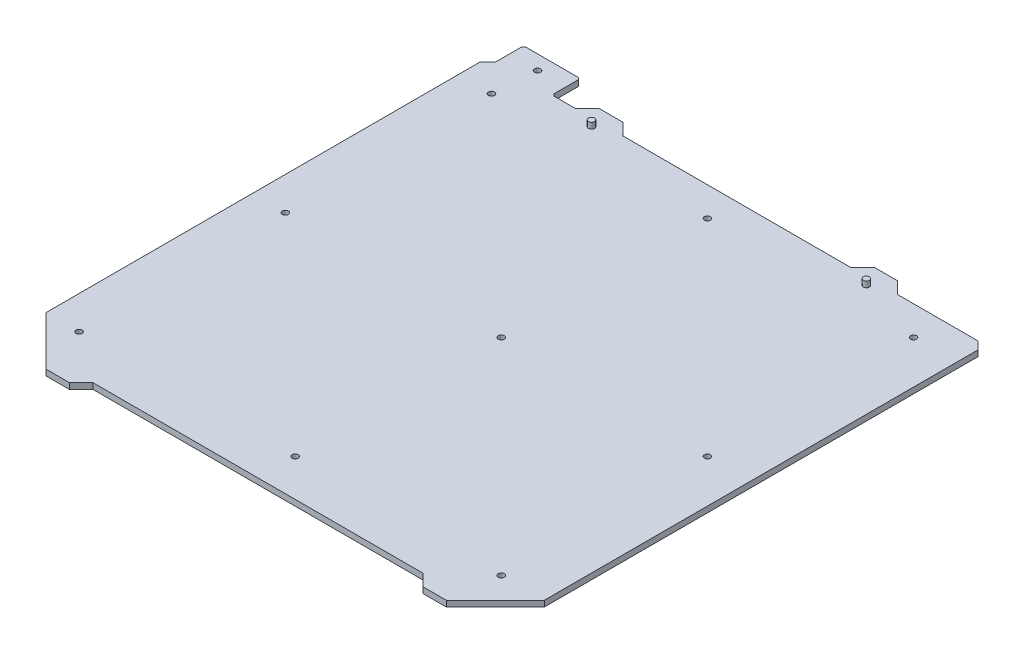
from build123d import *

# Parameters (mm, degrees)
BOSS_EXTRUDE1_DEPTH = 3
SKETCH2_R           = 1.55
CUT_EXTRUDE1_DEPTH  = 356.878676658
BOSS_EXTRUDE3_START = -6
SKETCH3_R           = 1.55
BOSS_EXTRUDE3_DEPTH = 6


with BuildPart() as part:
    # Sketch1 → Boss-Extrude1 (new body)
    with BuildSketch(Plane(origin=(0, 0, 0), x_dir=(1, 0, 0), z_dir=(0, 1, 0))):
        Polygon((5.02071, 249.35), (4.05, 248.379), (4.05, 235), (4.04962, 234.998), (4.04981, 234.996), (4.04812, 234.989), (4.04698, 234.983), (4.04588, 234.981), (4.04531, 234.979), (4.04157, 234.974), (4.0383, 234.968), (4.03662, 234.966), (4.03536, 234.965), (0.095609, 231.025), (0.1, 231), (0.1, 10.0414), (25.0414, -14.9), (36.9586, -14.9), (42.9293, -8.92929), (42.9329, -8.92677), (42.9357, -8.9234), (42.947, -8.91686), (42.9577, -8.90937), (42.962, -8.90823), (42.9658, -8.90603), (42.9787, -8.90376), (42.9913, -8.90038), (42.9957, -8.90076), (43, -8.9), (211, -8.9), (211.004, -8.90076), (211.009, -8.90038), (211.021, -8.90376), (211.034, -8.90603), (211.038, -8.90823), (211.042, -8.90937), (211.053, -8.91687), (211.064, -8.9234), (211.067, -8.92676), (211.071, -8.92929), (217.041, -14.9), (228.959, -14.9), (253.9, 10.0414), (253.9, 230.959), (249.959, 234.9), (209, 234.9), (208.966, 234.906), (208.936, 234.923), (208.913, 234.95), (208.902, 234.983), (208.902, 235.017), (208.904, 235.025), (202.979, 240.95), (191.021, 240.95), (185.096, 235.025), (185.098, 235.017), (185.098, 234.983), (185.087, 234.95), (185.064, 234.923), (185.034, 234.906), (185, 234.9), (69, 234.9), (68.9658, 234.906), (68.9357, 234.923), (68.9134, 234.95), (68.9015, 234.983), (68.9015, 235.017), (68.9043, 235.025), (62.9793, 240.95), (51.0207, 240.95), (45.0957, 235.025), (45.0985, 235.017), (45.0985, 234.983), (45.0866, 234.95), (45.0643, 234.923), (45.0342, 234.906), (45, 234.9), (34, 234.9), (33.9658, 234.906), (33.9357, 234.923), (33.9134, 234.95), (33.9015, 234.983), (33.9015, 235.017), (33.9043, 235.025), (32.9646, 235.965), (32.9634, 235.966), (32.9617, 235.968), (32.9584, 235.974), (32.9547, 235.979), (32.9541, 235.981), (32.953, 235.983), (32.9519, 235.989), (32.9502, 235.996), (32.9504, 235.998), (32.95, 236), (32.95, 248.379), (31.9793, 249.35), align=None)
    extrude(amount=BOSS_EXTRUDE1_DEPTH)

    # Sketch2 → Cut-Extrude1 (cut, through all)
    with BuildSketch(Plane(origin=(0, 3, 0), x_dir=(1, 0, 0), z_dir=(0, 1, 0))):
        with Locations(Location((17, 10.0414, 0), (0, 0, 270))):
            Circle(SKETCH2_R)
        with Locations(Location((127, 10.0414, 0), (0, 0, 270))):
            Circle(SKETCH2_R)
        with Locations(Location((232, 10.0414, 0), (0, 0, 270))):
            Circle(SKETCH2_R)
        with Locations(Location((232, 115.0414, 0), (0, 0, 270))):
            Circle(SKETCH2_R)
        with Locations(Location((232, 220.0414, 0), (0, 0, 270))):
            Circle(SKETCH2_R)
        with Locations(Location((127, 115.0414, 0), (0, 0, 270))):
            Circle(SKETCH2_R)
        with Locations(Location((17, 115.0414, 0), (0, 0, 270))):
            Circle(SKETCH2_R)
        with Locations(Location((17, 220.0414, 0), (0, 0, 270))):
            Circle(SKETCH2_R)
        with Locations(Location((127, 220.0414, 0), (0, 0, 270))):
            Circle(SKETCH2_R)
        with Locations(Location((197, 231, 0), (0, 0, 270))):
            Circle(SKETCH2_R)
        with Locations(Location((57, 231, 0), (0, 0, 270))):
            Circle(SKETCH2_R)
        with Locations(Location((18.499978099, 242, 0), (0, 0, 270))):
            Circle(SKETCH2_R)
    extrude(amount=-CUT_EXTRUDE1_DEPTH, mode=Mode.SUBTRACT)

    # Sketch3 → Boss-Extrude3 (add)
    with BuildSketch(Plane.XZ.offset(BOSS_EXTRUDE3_START)):
        with Locations(Location((57, -231, 0), (0, 0, 270))):
            Circle(SKETCH3_R)
        with Locations(Location((197, -231, 0), (0, 0, 270))):
            Circle(SKETCH3_R)
    extrude(amount=BOSS_EXTRUDE3_DEPTH)


solid = part.part
